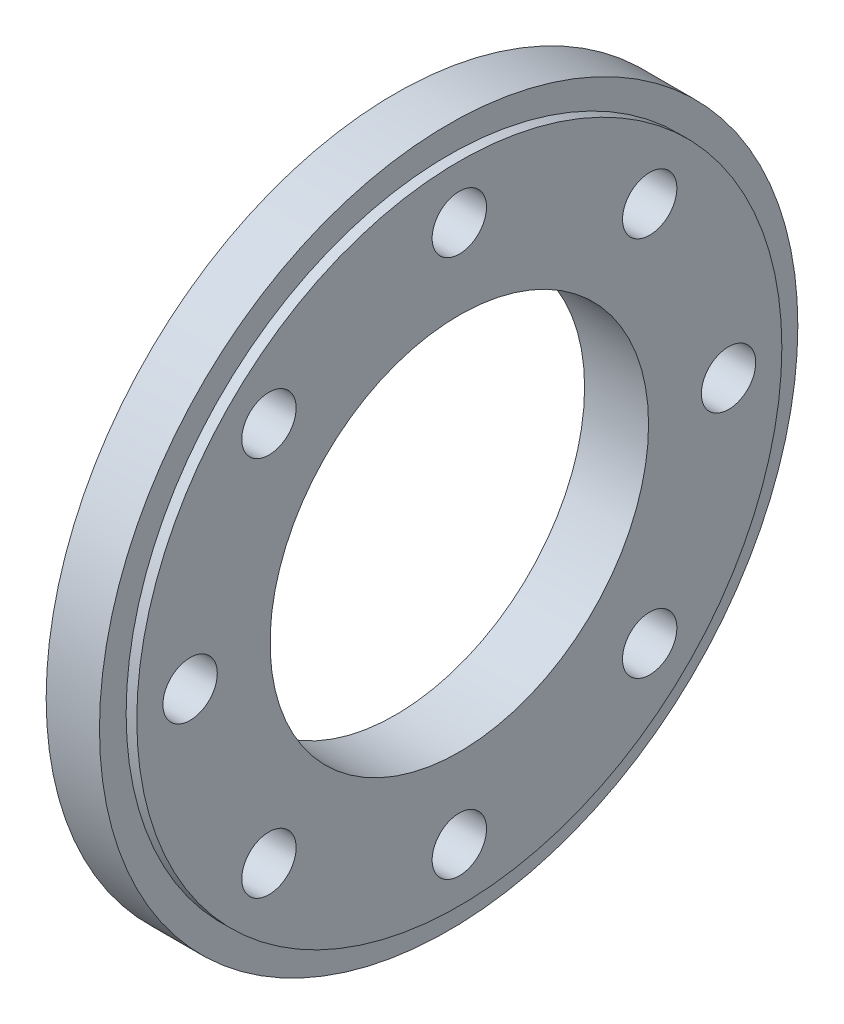
from build123d import *

# Parameters (mm, degrees)
SKETCH_1_R          = 65.5
SKETCH_1_R_2        = 35.5
SKETCH_1_R_3        = 5.1
EXTRUDE_1_DEPTH     = 6
SKETCH_2_R          = 65.5
SKETCH_2_R_2        = 60.5
CUT_EXTRUDE_1_DEPTH = 2


with BuildPart() as part:
    # Эскиз1 → Бобышка-Вытянуть1 (new, symmetric)
    with BuildSketch(Plane(origin=(0, 0, 0), x_dir=(0, 0, -1), z_dir=(1, 0, 0))):
        Circle(SKETCH_1_R)
        Circle(SKETCH_1_R_2, mode=Mode.SUBTRACT)
        with Locations((0, 50.5)):
            Circle(SKETCH_1_R_3, mode=Mode.SUBTRACT)
        with Locations((35.70889245, 35.70889245)):
            Circle(SKETCH_1_R_3, mode=Mode.SUBTRACT)
        with Locations((50.5, 0)):
            Circle(SKETCH_1_R_3, mode=Mode.SUBTRACT)
        with Locations((35.70889245, -35.70889245)):
            Circle(SKETCH_1_R_3, mode=Mode.SUBTRACT)
        with Locations((0, -50.5)):
            Circle(SKETCH_1_R_3, mode=Mode.SUBTRACT)
        with Locations((-35.70889245, -35.70889245)):
            Circle(SKETCH_1_R_3, mode=Mode.SUBTRACT)
        with Locations((-50.5, 0)):
            Circle(SKETCH_1_R_3, mode=Mode.SUBTRACT)
        with Locations((-35.70889245, 35.70889245)):
            Circle(SKETCH_1_R_3, mode=Mode.SUBTRACT)
    extrude(amount=EXTRUDE_1_DEPTH, both=True)

    # Эскиз2 → Вырез-Вытянуть1 (cut)
    with BuildSketch(Plane(origin=(6, 0, 0), x_dir=(0, 0, -1), z_dir=(1, 0, 0))):
        Circle(SKETCH_2_R)
        Circle(SKETCH_2_R_2, mode=Mode.SUBTRACT)
    extrude(amount=-CUT_EXTRUDE_1_DEPTH, mode=Mode.SUBTRACT)


solid = part.part
